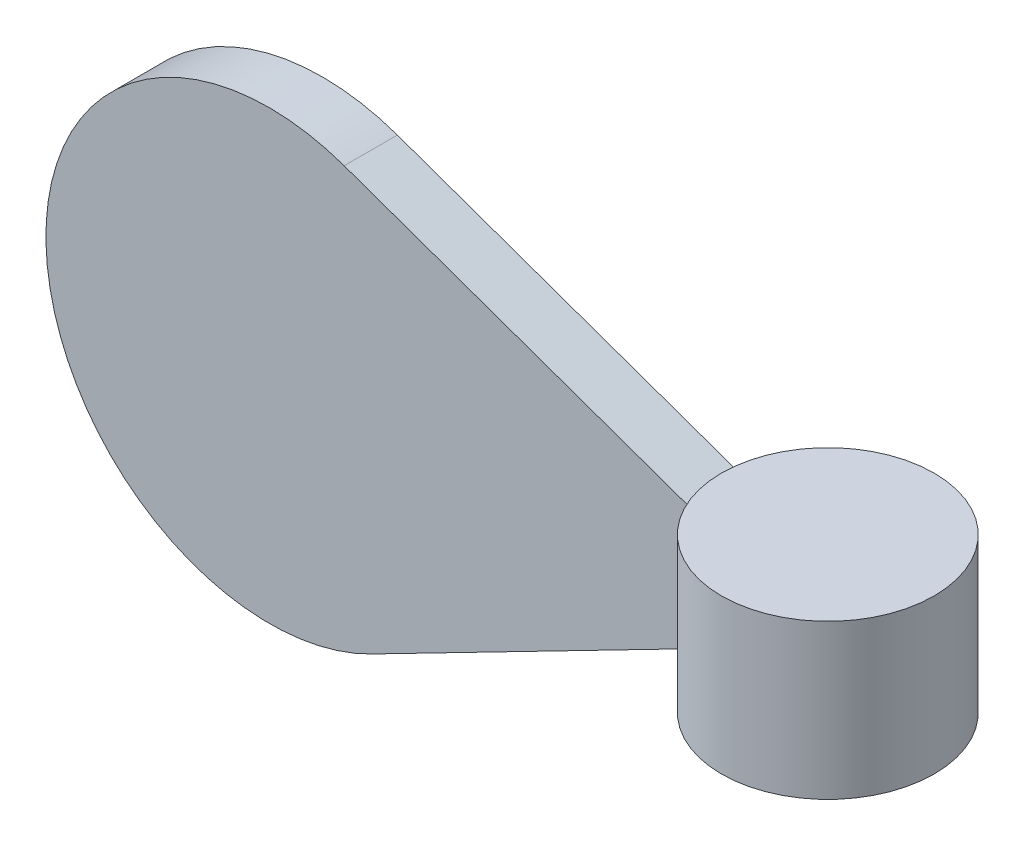
from build123d import *

# Parameters (mm, degrees)
SKETCH_1_R          = 42
EXTRUDE_1_DEPTH     = 20
EXTRUDE_2_DEPTH     = 5
SKETCH_4_R          = 42
CUT_EXTRUDE_1_DEPTH = 15


with BuildPart() as part:
    # 草图1 → 凸台-拉伸1 (new body)
    with BuildSketch(Plane.XY):
        Circle(SKETCH_1_R)
    extrude(amount=EXTRUDE_1_DEPTH)



with BuildPart() as body_2:
    # 草图2 → 旋转1 (revolve)
    with BuildSketch(Plane.XY.offset(20), mode=Mode.PRIVATE) as revolve_1_sk:
        with BuildLine():
            Line((100, 20), (100, 15))
            ThreePointArc((100, 15), (86.583592135, 6.708203932), (88, -9))
            Line((88, -9), (80, -9))
            Line((80, -9), (80, 20))
            Line((80, 20), (100, 20))
        make_face()
    revolve(revolve_1_sk.sketch.rotate(Axis((100, 22.717290725, 20), (0, -1, 0)), 270), axis=Axis((100, 22.717290725, 20), (0, -1, 0)))


with BuildPart() as part_1:
    add(part.part)

    add(body_2.part)  # 凸台-拉伸2 merges body 2
    # 草图3 → 凸台-拉伸2 (add, symmetric)
    with BuildSketch(Plane.XY.offset(20)):
        with BuildLine():
            Line((14.069453744, 39.573355574), (86, 14))
            Line((86, 14), (86, -3))
            Line((86, -3), (19.208719722, -37.350034627))
            ThreePointArc((19.208719722, -37.350034627), (-41.906577017, -2.79978619), (14.069453744, 39.573355574))
        make_face()
    extrude(amount=EXTRUDE_2_DEPTH, both=True)

    # 草图4 → 切除-拉伸1 (cut)
    with BuildSketch(Plane(origin=(0, 0, 0), x_dir=(-1, 0, 0), z_dir=(0, 0, -1))):
        Circle(SKETCH_4_R)
    extrude(amount=-CUT_EXTRUDE_1_DEPTH, mode=Mode.SUBTRACT)


solid = part_1.part
